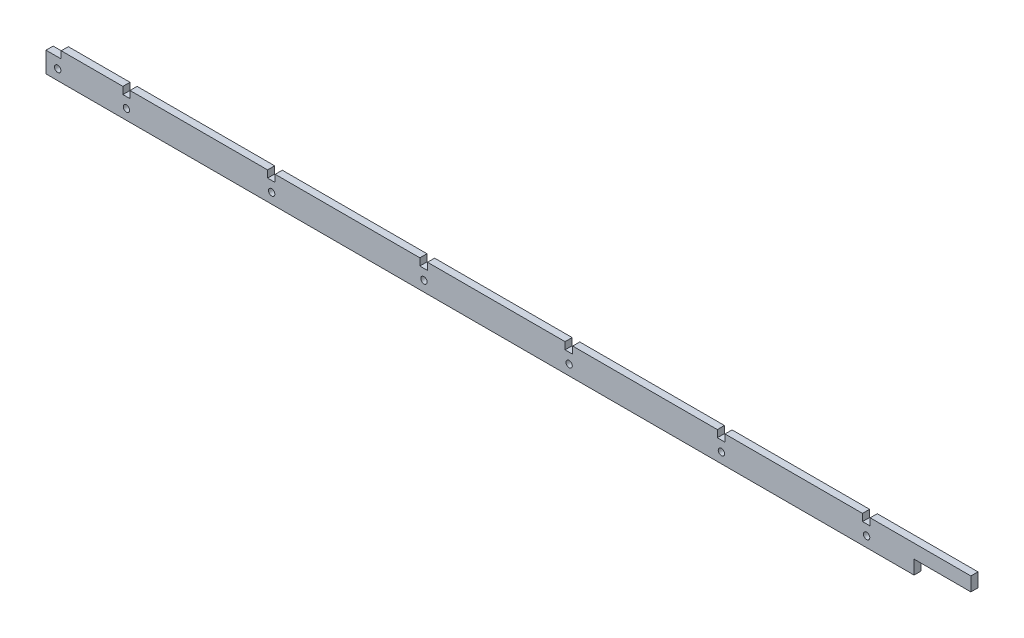
from build123d import *

# Parameters (mm, degrees)
SKETCH1_R           = 1.4224
BOSS_EXTRUDE1_DEPTH = 3.175


with BuildPart() as part:
    # Sketch1 → Boss-Extrude1 (new body)
    with BuildSketch(Plane.XY):
        Polygon((5915.081902132, 2730.775703183), (5915.081902132, 2727.600703183), (5908.274702132, 2727.600703183), (5908.274702132, 2718.405903183), (6296.221602132, 2718.405903183), (6296.221602132, 2724.590803183), (6321.621602132, 2724.590803183), (6321.621602132, 2730.775703183), (6276.593752132, 2730.775703183), (6276.593752132, 2727.600703184), (6273.190152132, 2727.600703184), (6273.190152132, 2730.775703183), (6211.709452132, 2730.775703183), (6211.709452132, 2727.600703184), (6208.305852132, 2727.600703184), (6208.305852132, 2730.775703183), (6143.650152132, 2730.775703183), (6143.650152132, 2727.600703184), (6140.246552132, 2727.600703184), (6140.246552132, 2730.775703183), (6078.765852132, 2730.775703183), (6078.765852132, 2727.600703183), (6075.362252132, 2727.600703183), (6075.362252132, 2730.775703183), (6010.706552132, 2730.775703183), (6010.706552132, 2727.600703183), (6007.302952132, 2727.600703183), (6007.302952132, 2730.775703183), (5945.822252132, 2730.775703183), (5945.822252132, 2727.600703183), (5942.647252132, 2727.600703183), (5942.647252132, 2730.775703183), align=None)
        with Locations((5944.234752132, 2723.003303183)):
            Circle(SKETCH1_R, mode=Mode.SUBTRACT)
        with Locations((6009.119052132, 2723.003303183)):
            Circle(SKETCH1_R, mode=Mode.SUBTRACT)
        with Locations((6077.178352132, 2723.003303183)):
            Circle(SKETCH1_R, mode=Mode.SUBTRACT)
        with Locations((6142.062652132, 2723.003303183)):
            Circle(SKETCH1_R, mode=Mode.SUBTRACT)
        with Locations((6210.121952132, 2723.003303183)):
            Circle(SKETCH1_R, mode=Mode.SUBTRACT)
        with Locations((6275.006252132, 2723.003303183)):
            Circle(SKETCH1_R, mode=Mode.SUBTRACT)
        with Locations((5913.494402132, 2723.003303183)):
            Circle(SKETCH1_R, mode=Mode.SUBTRACT)
    extrude(amount=BOSS_EXTRUDE1_DEPTH)


solid = part.part
